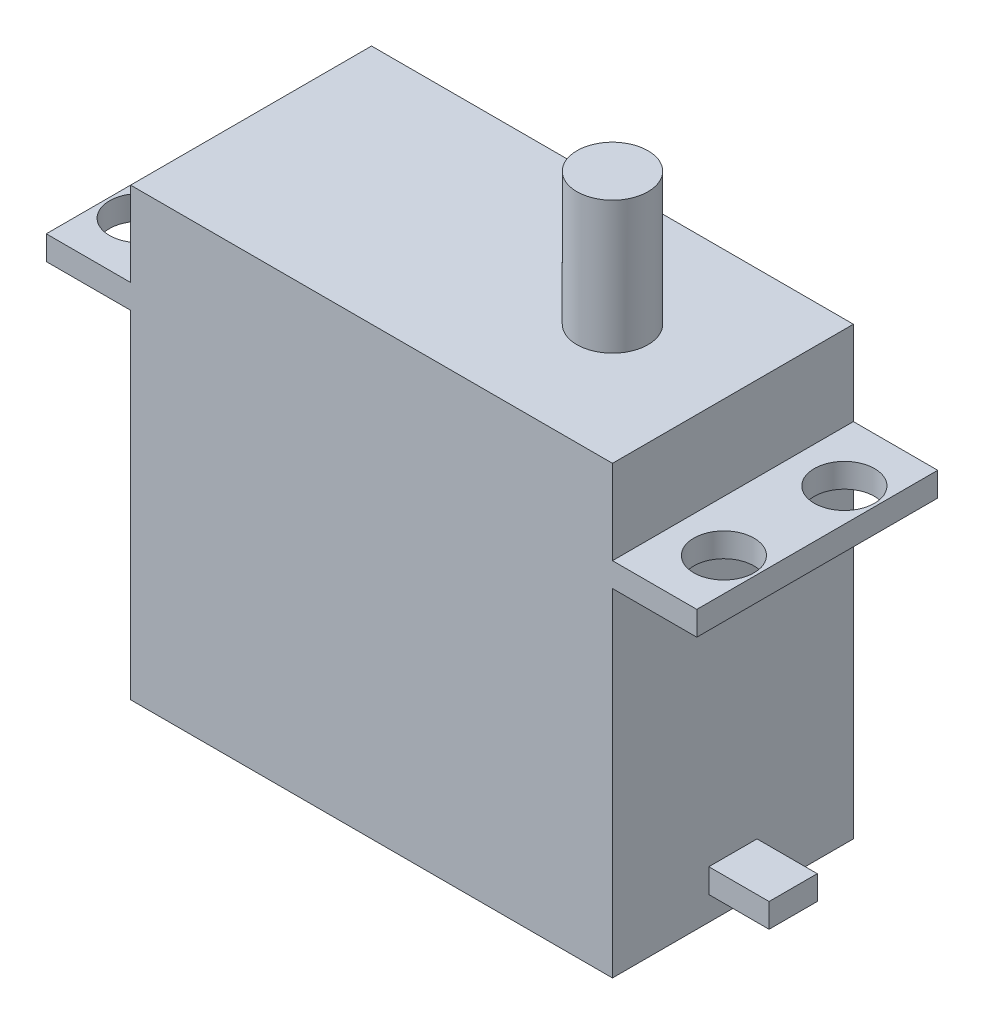
from build123d import *

# Parameters (mm, degrees)
BOSS_EXTRUDE1_DEPTH = 20
SKETCH2_R           = 2.95
BOSS_EXTRUDE2_DEPTH = 11
SKETCH4_R           = 2.5
CUT_EXTRUDE1_DEPTH  = 3
SKETCH5_W           = 4
SKETCH5_H           = 2
BOSS_EXTRUDE3_DEPTH = 5


with BuildPart() as part:
    # Sketch1 → Boss-Extrude1 (new body)
    with BuildSketch(Plane.XY):
        Polygon((0, -9), (0, -37), (40, -37), (40, -9), (47, -9), (47, -7), (40, -7), (40, 0), (0, 0), (0, -7), (-7, -7), (-7, -9), align=None)
    extrude(amount=BOSS_EXTRUDE1_DEPTH)

    # Sketch2 → Boss-Extrude2 (add)
    with BuildSketch(Plane(origin=(0, 0, 0), x_dir=(1, 0, 0), z_dir=(0, 1, 0))):
        with Locations(Location((30, -10, 0), (0, 0, 90))):
            Circle(SKETCH2_R)
    extrude(amount=BOSS_EXTRUDE2_DEPTH)

    # Sketch4 → Cut-Extrude1 (cut)
    with BuildSketch(Plane(origin=(0, -7, 0), x_dir=(1, 0, 0), z_dir=(0, 1, 0))):
        with Locations(Location((-4.25, -5, 0), (0, 0, 270))):
            Circle(SKETCH4_R)
        with Locations(Location((-4.25, -15, 0), (0, 0, 270))):
            Circle(SKETCH4_R)
        with Locations(Location((44.25, -5, 0), (0, 0, 270))):
            Circle(SKETCH4_R)
        with Locations(Location((44.25, -15, 0), (0, 0, 270))):
            Circle(SKETCH4_R)
    extrude(amount=-CUT_EXTRUDE1_DEPTH, mode=Mode.SUBTRACT)

    # Sketch5 → Boss-Extrude3 (add)
    with BuildSketch(Plane(origin=(40, 0, 0), x_dir=(0, 0, -1), z_dir=(1, 0, 0))):
        with Locations((-10, -34)):
            Rectangle(SKETCH5_W, SKETCH5_H)
    extrude(amount=BOSS_EXTRUDE3_DEPTH)


solid = part.part
